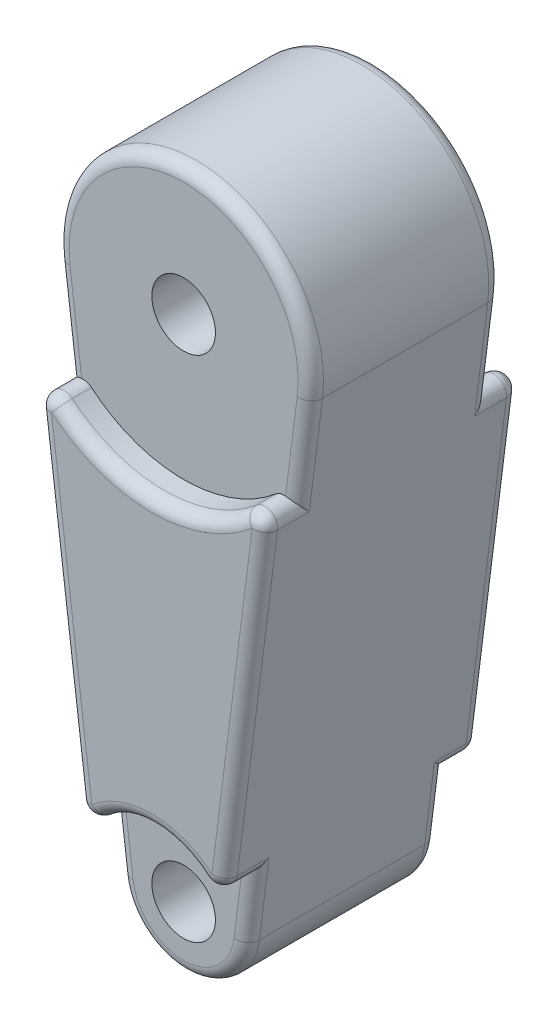
from build123d import *

# Parameters (mm, degrees)
SKETCH1_R            = 6.35
SKETCH1_R_2          = 6.349999999999998
BOSS_EXTRUDE1_DEPTH  = 19.05
BOSS_EXTRUDE2_DEPTH  = 6.35
FILLET1_R            = 2.54
FILLET1_OF_MIRROR4_R = 2.54


with BuildPart() as part:
    # Sketch1 → Boss-Extrude1 (new body)
    with BuildSketch(Plane.XY):
        with BuildLine():
            Line((-25.20078123789022, 98.425), (-12.600390618945115, -1.5875000000000004))
            ThreePointArc((-12.600390618945115, -1.5875000000000004), (7.8e-16, -12.700000000000003), (12.600390618945115, -1.5875000000000004))
            Line((12.600390618945115, -1.5875000000000004), (25.20078123789022, 98.425))
            ThreePointArc((25.20078123789022, 98.425), (-4.67e-15, 126.99999999999999), (-25.20078123789022, 98.425))
        make_face()
        with Locations(Location((0, 0, 0), (0, 0, 180))):
            Circle(SKETCH1_R, mode=Mode.SUBTRACT)
        with Locations(Location((0, 101.6, 0), (0, 0, 180))):
            Circle(SKETCH1_R_2, mode=Mode.SUBTRACT)
    boss_extrude1 = extrude(amount=BOSS_EXTRUDE1_DEPTH)

    # Sketch2 → Boss-Extrude2 (add)
    with BuildSketch(Plane.XY.offset(19.05)):
        with BuildLine():
            Line((-23.56442369272321, 85.43681463851183), (-13.791015618945115, 7.862792964208833))
            ThreePointArc((-13.791015618945114, 7.8627929642088334), (-2.55e-15, 15.875), (13.791015618945112, 7.862792964208835))
            Line((13.791015618945114, 7.862792964208836), (23.56442369272321, 85.43681463851183))
            ThreePointArc((23.564423692723203, 85.43681463851182), (-5.25e-15, 73.02499999999999), (-23.56442369272321, 85.43681463851183))
        make_face()
    boss_extrude2 = extrude(amount=BOSS_EXTRUDE2_DEPTH)

    # Fillet1
    fillet1_edges = [part.edges().sort_by_distance(p)[0] for p in [
        (-2.22e-15, -12.700000000000003, 19.05),
        (13.195703118945115, 3.137646482104417, 19.05),
        (-13.195703118945115, 3.137646482104415, 19.05),
        (24.382602465306718, 91.93090731925592, 19.05),
        (8.9e-16, 15.875000000000002, 25.4),
        (-13.791015618945114, 7.862792964208833, 22.225),
        (13.791015618945114, 7.862792964208834, 22.225),
        (-1.066e-14, 73.02499999999999, 25.4),
        (23.564423692723206, 85.43681463851183, 22.225),
        (-23.564423692723214, 85.43681463851183, 22.225),
        (18.67771965583416, 46.649803801360335, 25.4),
        (-18.677719655834164, 46.649803801360335, 25.4),
        (-3.11e-15, 126.99999999999999, 19.05),
        (-24.382602465306714, 91.93090731925591, 19.05),
    ]]
    fillet(fillet1_edges, radius=FILLET1_R)

    # Mirror4: Boss-Extrude1, Boss-Extrude2 across plane
    add(boss_extrude1.mirror(Plane(origin=(0, 101.6, 0), x_dir=(1, 0, 0), z_dir=(0, 0, -1))))
    add(boss_extrude2.mirror(Plane(origin=(0, 101.6, 0), x_dir=(1, 0, 0), z_dir=(0, 0, -1))))

    # Fillet1 of Mirror4
    fillet1_of_mirror4_edges = [part.edges().sort_by_distance(p)[0] for p in [
        (-2.22e-15, -12.700000000000003, -19.05),
        (13.195703118945115, 3.137646482104417, -19.05),
        (-13.195703118945115, 3.137646482104415, -19.05),
        (24.382602465306718, 91.93090731925592, -19.05),
        (8.9e-16, 15.875000000000002, -25.4),
        (-13.791015618945114, 7.862792964208833, -22.225),
        (13.791015618945114, 7.862792964208834, -22.225),
        (-1.066e-14, 73.02499999999999, -25.4),
        (23.564423692723206, 85.43681463851183, -22.225),
        (-23.564423692723214, 85.43681463851183, -22.225),
        (18.67771965583416, 46.649803801360335, -25.4),
        (-18.677719655834164, 46.649803801360335, -25.4),
        (-3.11e-15, 126.99999999999999, -19.05),
        (-24.382602465306714, 91.93090731925591, -19.05),
    ]]
    fillet(fillet1_of_mirror4_edges, radius=FILLET1_OF_MIRROR4_R)


solid = part.part
